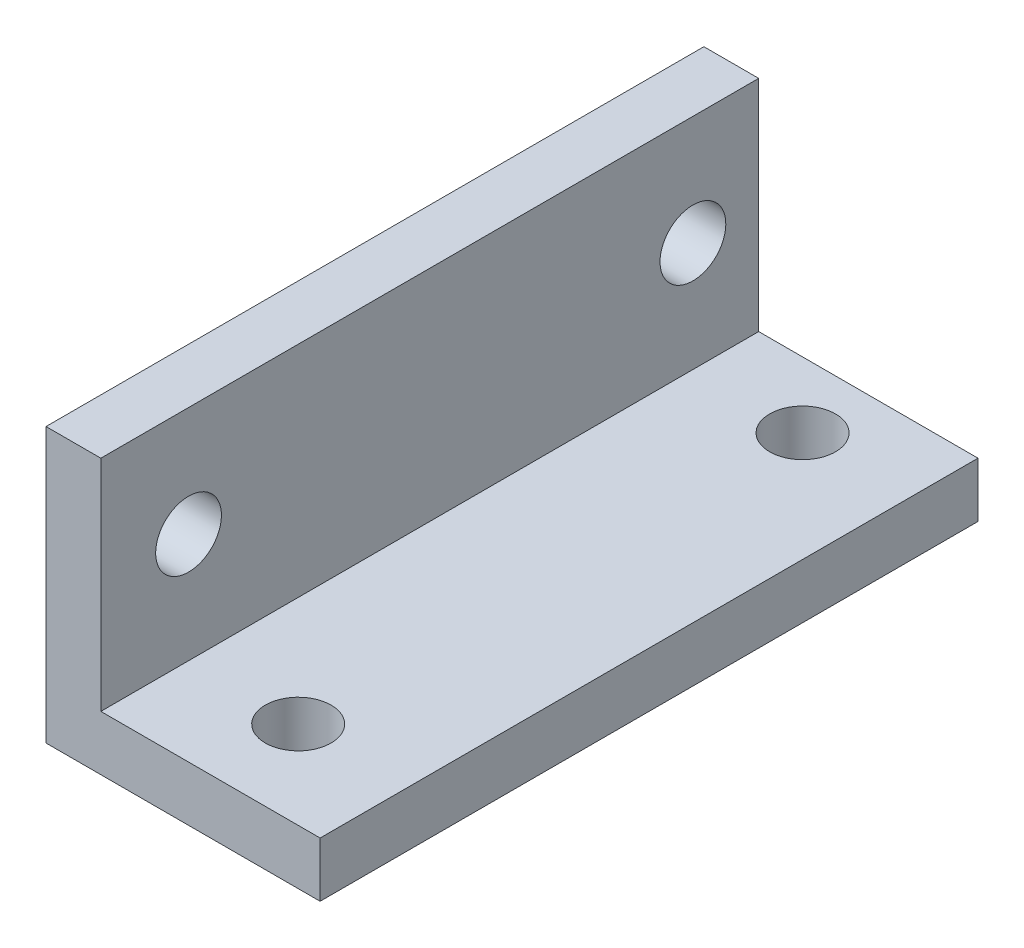
from build123d import *

# Parameters (mm, degrees)
EXTRUDE_1_DEPTH     = 60
SKETCH_2_R          = 3
CUT_EXTRUDE_1_DEPTH = 69.007352544
SKETCH_3_R          = 3
CUT_EXTRUDE_2_DEPTH = 69.007352544


with BuildPart() as part:
    # 草图1 → 凸台-拉伸1 (new body)
    with BuildSketch(Plane.XY):
        Polygon((0, 0), (5, 0), (5, -20), (25, -20), (25, -25), (0, -25), align=None)
    extrude(amount=EXTRUDE_1_DEPTH)

    # 草图2 → 切除-拉伸1 (cut, through all)
    with BuildSketch(Plane(origin=(0, -20, 0), x_dir=(1, 0, 0), z_dir=(0, 1, 0))):
        with Locations(Location((15, -6, 0), (0, 0, 180))):
            Circle(SKETCH_2_R)
        with Locations(Location((15, -52, 0), (0, 0, 180))):
            Circle(SKETCH_2_R)
    extrude(amount=-CUT_EXTRUDE_1_DEPTH, mode=Mode.SUBTRACT)

    # 草图3 → 切除-拉伸2 (cut, through all)
    with BuildSketch(Plane(origin=(5, 0, 0), x_dir=(0, 0, -1), z_dir=(1, 0, 0))):
        with Locations(Location((-6, -10, 0), (0, 0, 90))):
            Circle(SKETCH_3_R)
        with Locations(Location((-52, -10, 0), (0, 0, 90))):
            Circle(SKETCH_3_R)
    extrude(amount=-CUT_EXTRUDE_2_DEPTH, mode=Mode.SUBTRACT)


solid = part.part
